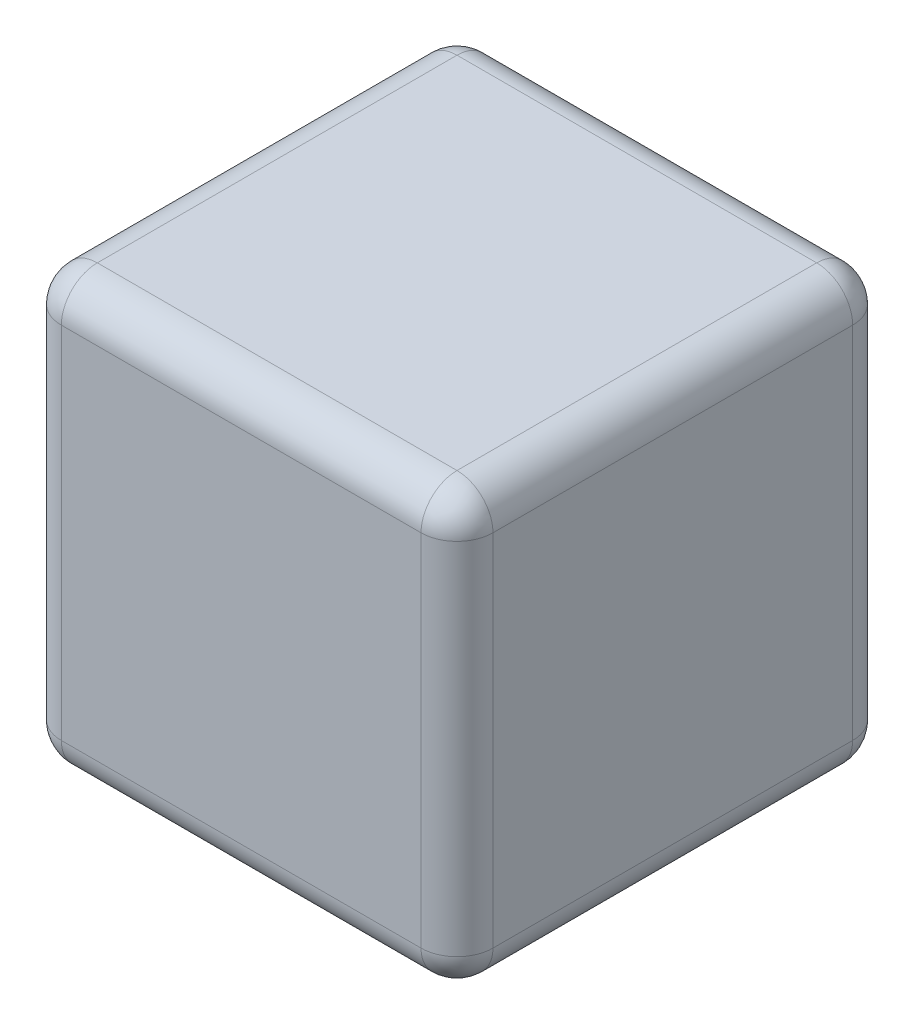
from build123d import *

# Parameters (mm, degrees)
SKETCH1_W           = 3
SKETCH1_H           = 3
BOSS_EXTRUDE1_DEPTH = 3
FILLET1_R           = 0.25


with BuildPart() as part:
    # Sketch1 → Boss-Extrude1 (new body)
    with BuildSketch(Plane.XY):
        Rectangle(SKETCH1_W, SKETCH1_H)
    extrude(amount=BOSS_EXTRUDE1_DEPTH)

    # Fillet1
    fillet1_edges = [part.edges().sort_by_distance(p)[0] for p in [
        (-1.5, 0, 3),
        (0, -1.5, 3),
        (1.5, 0, 3),
        (0, -1.5, 0),
        (-1.5, 0, 0),
        (0, 1.5, 0),
        (1.5, 0, 0),
        (0, 1.5, 3),
        (1.5, -1.5, 1.5),
        (-1.5, -1.5, 1.5),
        (-1.5, 1.5, 1.5),
        (1.5, 1.5, 1.5),
    ]]
    fillet(fillet1_edges, radius=FILLET1_R)


solid = part.part
